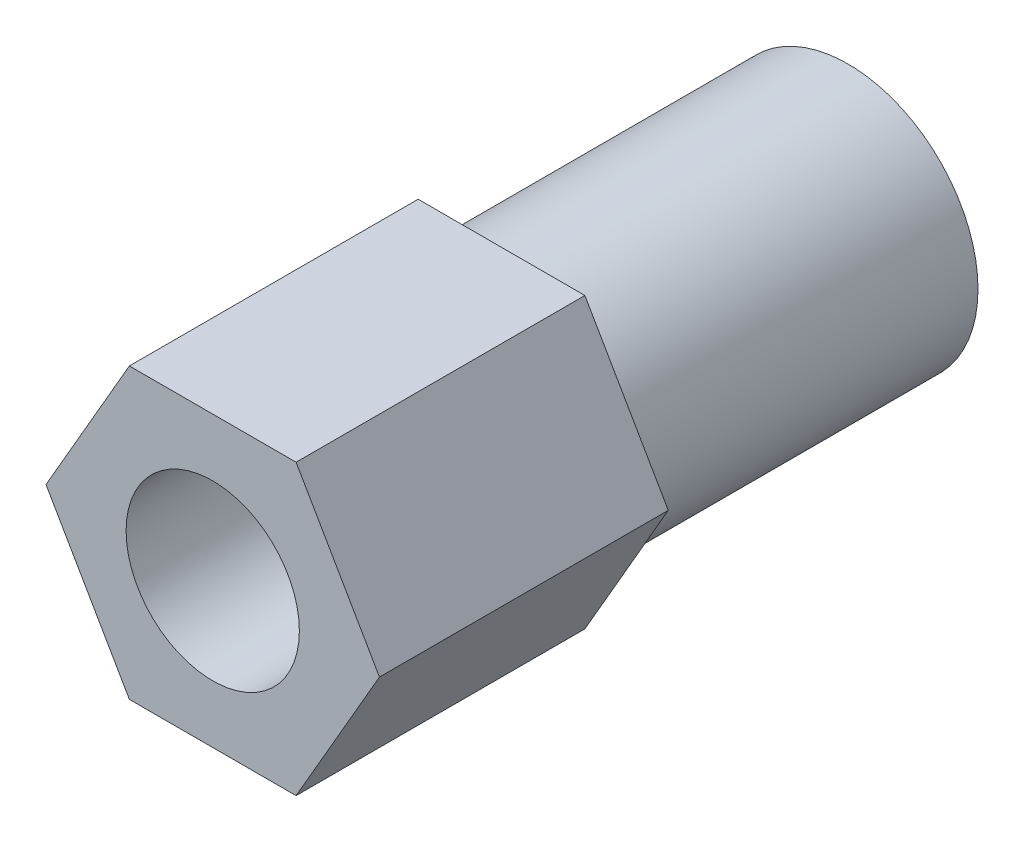
from build123d import *
from build123d.topology import SkipClean

# Parameters (mm, degrees)
ESQUISSE1_R        = 1.5
BOSS_EXTRU_1_DEPTH = 5
BOSS_EXTRU_2_START = 6
ESQUISSE2_R        = 2.25
ESQUISSE2_R_2      = 1.5
BOSS_EXTRU_2_DEPTH = 6


with BuildPart() as part:
    # Esquisse1 → Boss.-Extru.1 (new body)
    with BuildSketch(Plane.XY):
        Polygon((-2.886751346, 0), (-1.443375673, -2.5), (1.443375673, -2.5), (2.886751346, 0), (1.443375673, 2.5), (-1.443375673, 2.5), align=None)
        Circle(ESQUISSE1_R, mode=Mode.SUBTRACT)
    extrude(amount=BOSS_EXTRU_1_DEPTH)

    # Esquisse2 → Boss.-Extru.2 (add)
    with SkipClean():  # the faces are left unmerged after this step: merging them gives an invalid solid
        with BuildSketch(Plane(origin=(0, 0, 0), x_dir=(-1, 0, 0), z_dir=(0, 0, -1)).offset(BOSS_EXTRU_2_START)):
            with Locations(Location((0, 0, 0), (0, 0, 180))):
                Circle(ESQUISSE2_R)
            Circle(ESQUISSE2_R_2, mode=Mode.SUBTRACT)
        extrude(amount=-BOSS_EXTRU_2_DEPTH)


solid = part.part
